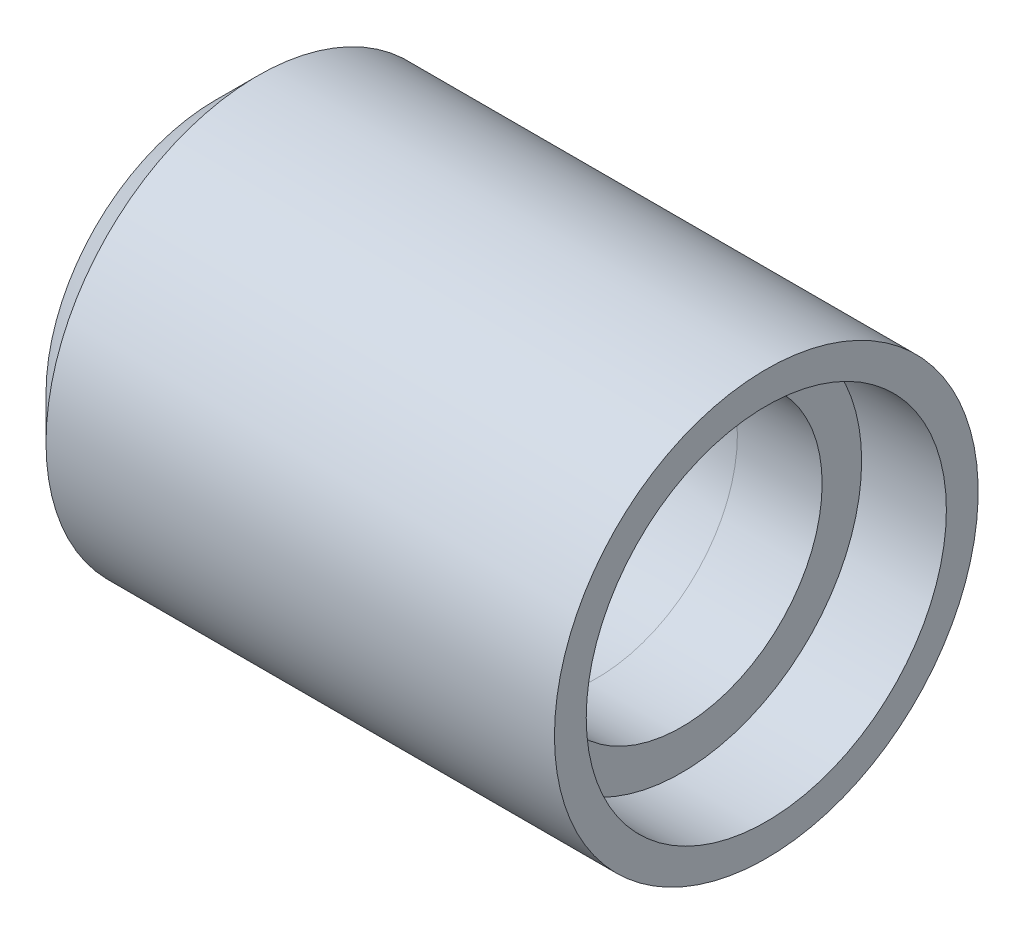
from build123d import *


with BuildPart() as part:
    # Sketch1 → Revolve1 (revolve)
    with BuildSketch(Plane.XY, mode=Mode.PRIVATE) as revolve1_sk:
        Polygon((1, 5), (13, 5), (13, 4.25), (11, 4.25), (11, 3.317588424), (9, 3.317588424), (1.2, 4), (1.2, 3), (0.5, 3), (0.5, 3.5), (0, 3.5), (0, 4), align=None)
    revolve(revolve1_sk.sketch.rotate(Axis((0, 0, 0), (1, 0, 0)), 90), axis=Axis((0, 0, 0), (1, 0, 0)))


solid = part.part
